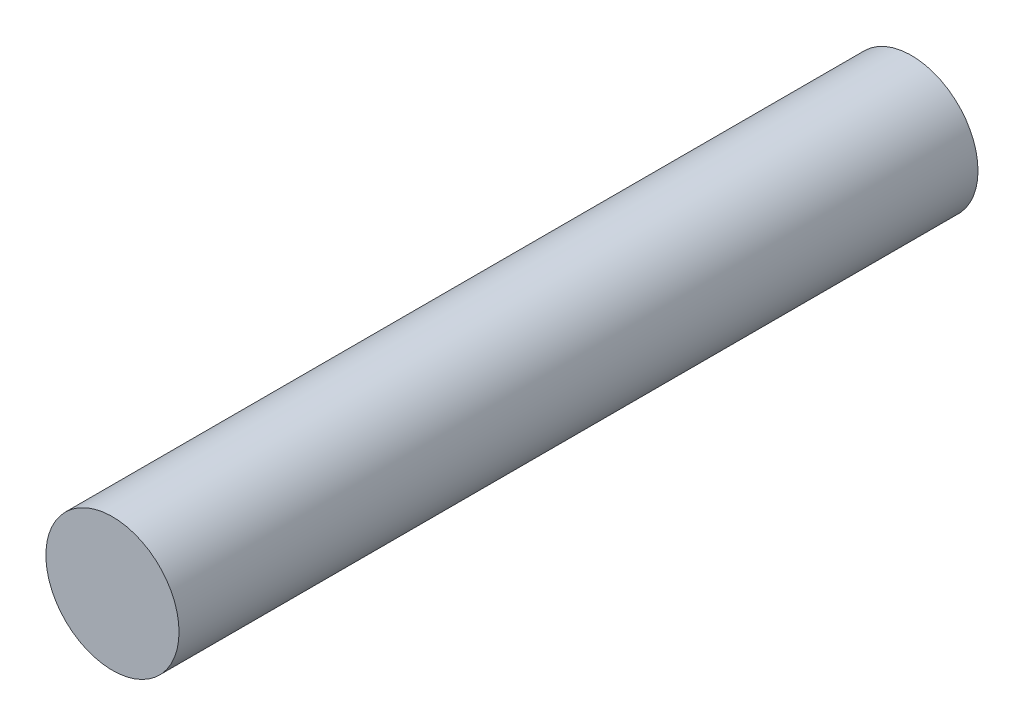
from build123d import *

# Parameters (mm, degrees)
SKETCH1_R      = 25.4
EXTRUDE1_DEPTH = 304.8


with BuildPart() as part:
    # Sketch1 → Extrude1 (new body)
    with BuildSketch(Plane.XY):
        Circle(SKETCH1_R)
    extrude(amount=-EXTRUDE1_DEPTH)


solid = part.part
